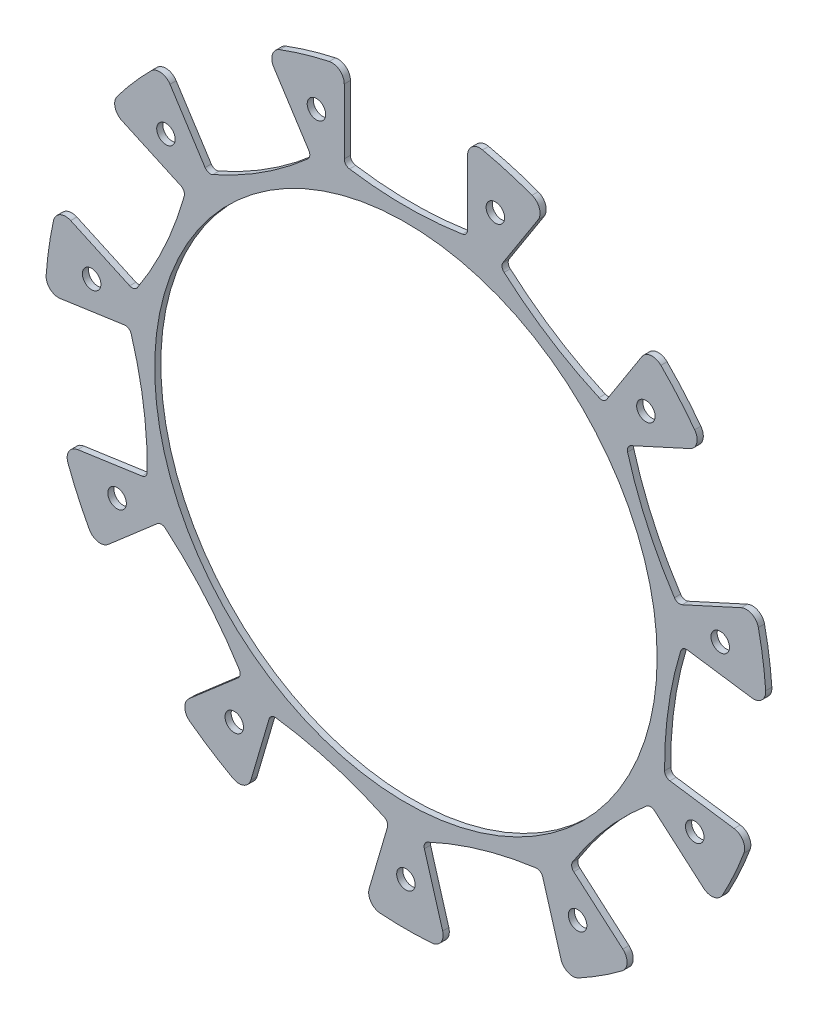
from build123d import *

# Parameters (mm, degrees)
SKETCH_2_R      = 40.75
SKETCH_2_R_2    = 1.5
EXTRUDE_1_DEPTH = 1
FILLET_1_R      = 1
FILLET_2_R      = 2


with BuildPart() as part:
    # 草图2 → 凸台-拉伸1 (new body)
    with BuildSketch(Plane.XY):
        with BuildLine():
            Line((10, 57.638962517), (10, 43.839202169))
            ThreePointArc((10, 43.839202169), (0, 43), (-10, 43.839202169))
            Line((-10, 43.839202169), (-10, 57.638962517))
            ThreePointArc((-10, 57.638962517), (-16.481354575, 56.130338956), (-22.749440484, 53.89538902))
            Line((-22.749440484, 53.89538902), (-15.288726769, 42.286291876))
            ThreePointArc((-15.288726769, 42.286291876), (-23.247555151, 36.173901912), (-32.113797426, 31.473475527))
            Line((-32.113797426, 31.473475527), (-39.574511141, 43.082572671))
            ThreePointArc((-39.574511141, 43.082572671), (-44.2113501, 38.309352936), (-48.276094354, 33.040410317))
            Line((-48.276094354, 33.040410317), (-35.723390814, 27.307782693))
            ThreePointArc((-35.723390814, 27.307782693), (-39.1141758, 17.862845559), (-44.031691074, 9.115142785))
            Line((-44.031691074, 9.115142785), (-56.584394614, 14.84777041))
            ThreePointArc((-56.584394614, 14.84777041), (-57.90455435, 8.325418039), (-58.47542937, 1.69533479))
            Line((-58.47542937, 1.69533479), (-44.816130685, 3.659245452))
            ThreePointArc((-44.816130685, 3.659245452), (-42.562322001, -6.119538046), (-41.969833919, -16.137183386))
            Line((-41.969833919, -16.137183386), (-55.629132604, -18.101094048))
            ThreePointArc((-55.629132604, -18.101094048), (-53.213471728, -24.301778261), (-50.109228728, -30.187997554))
            Line((-50.109228728, -30.187997554), (-39.680065719, -21.151076364))
            ThreePointArc((-39.680065719, -21.151076364), (-32.497231697, -28.15901156), (-26.58285104, -36.266067852))
            Line((-26.58285104, -36.266067852), (-37.012014049, -45.302989041))
            ThreePointArc((-37.012014049, -45.302989041), (-31.627487821, -49.213331671), (-25.83370202, -52.486853973))
            Line((-25.83370202, -52.486853973), (-21.945860253, -39.246080882))
            ThreePointArc((-21.945860253, -39.246080882), (-12.114499944, -41.258197865), (-2.756000781, -44.880732018))
            Line((-2.756000781, -44.880732018), (-6.643842547, -58.12150511))
            ThreePointArc((-6.643842547, -58.12150511), (0, -58.5), (6.643842547, -58.12150511))
            Line((6.643842547, -58.12150511), (2.756000781, -44.880732018))
            ThreePointArc((2.756000781, -44.880732018), (12.114499944, -41.258197865), (21.945860253, -39.246080882))
            Line((21.945860253, -39.246080882), (25.83370202, -52.486853973))
            ThreePointArc((25.83370202, -52.486853973), (31.627487821, -49.213331671), (37.012014049, -45.302989041))
            Line((37.012014049, -45.302989041), (26.58285104, -36.266067852))
            ThreePointArc((26.58285104, -36.266067852), (32.497231697, -28.15901156), (39.680065719, -21.151076364))
            Line((39.680065719, -21.151076364), (50.109228728, -30.187997554))
            ThreePointArc((50.109228728, -30.187997554), (53.213471728, -24.301778261), (55.629132604, -18.101094048))
            Line((55.629132604, -18.101094048), (41.969833919, -16.137183386))
            ThreePointArc((41.969833919, -16.137183386), (42.562322001, -6.119538046), (44.816130685, 3.659245452))
            Line((44.816130685, 3.659245452), (58.47542937, 1.69533479))
            ThreePointArc((58.47542937, 1.69533479), (57.90455435, 8.325418039), (56.584394614, 14.84777041))
            Line((56.584394614, 14.84777041), (44.031691074, 9.115142785))
            ThreePointArc((44.031691074, 9.115142785), (39.1141758, 17.862845559), (35.723390814, 27.307782693))
            Line((35.723390814, 27.307782693), (48.276094354, 33.040410317))
            ThreePointArc((48.276094354, 33.040410317), (44.2113501, 38.309352936), (39.574511141, 43.082572671))
            Line((39.574511141, 43.082572671), (32.113797426, 31.473475527))
            ThreePointArc((32.113797426, 31.473475527), (23.247555151, 36.173901912), (15.288726769, 42.286291876))
            Line((15.288726769, 42.286291876), (22.749440484, 53.89538902))
            ThreePointArc((22.749440484, 53.89538902), (16.481354575, 56.130338956), (10, 57.638962517))
        make_face()
        Circle(SKETCH_2_R, mode=Mode.SUBTRACT)
        with Locations((0, -51.5)):
            Circle(SKETCH_2_R_2, mode=Mode.SUBTRACT)
        with Locations((-27.843002099, -43.324556941)):
            Circle(SKETCH_2_R_2, mode=Mode.SUBTRACT)
        with Locations((-46.846047761, -21.39387317)):
            Circle(SKETCH_2_R_2, mode=Mode.SUBTRACT)
        with Locations((-50.975804257, 7.329214171)):
            Circle(SKETCH_2_R_2, mode=Mode.SUBTRACT)
        with Locations((-38.921103079, 33.725327798)):
            Circle(SKETCH_2_R_2, mode=Mode.SUBTRACT)
        with Locations((-14.509226677, 49.413888141)):
            Circle(SKETCH_2_R_2, mode=Mode.SUBTRACT)
        with Locations((14.509226677, 49.413888141)):
            Circle(SKETCH_2_R_2, mode=Mode.SUBTRACT)
        with Locations((38.921103079, 33.725327798)):
            Circle(SKETCH_2_R_2, mode=Mode.SUBTRACT)
        with Locations((50.975804257, 7.329214171)):
            Circle(SKETCH_2_R_2, mode=Mode.SUBTRACT)
        with Locations((46.846047761, -21.39387317)):
            Circle(SKETCH_2_R_2, mode=Mode.SUBTRACT)
        with Locations((27.843002099, -43.324556941)):
            Circle(SKETCH_2_R_2, mode=Mode.SUBTRACT)
    extrude(amount=EXTRUDE_1_DEPTH)

    # 圆角1
    fillet_1_edges = [part.edges().sort_by_distance(p)[0] for p in [
        (10, 43.839202169, 0.5),
        (-10, 43.839202169, 0.5),
        (-15.288726769, 42.286291876, 0.5),
        (-32.113797426, 31.473475527, 0.5),
        (-35.723390814, 27.307782693, 0.5),
        (-44.031691074, 9.115142785, 0.5),
        (-44.816130685, 3.659245452, 0.5),
        (-41.969833919, -16.137183386, 0.5),
        (-39.680065719, -21.151076364, 0.5),
        (-26.58285104, -36.266067852, 0.5),
        (-21.945860253, -39.246080882, 0.5),
        (-2.756000781, -44.880732018, 0.5),
        (2.756000781, -44.880732018, 0.5),
        (21.945860253, -39.246080882, 0.5),
        (26.58285104, -36.266067852, 0.5),
        (39.680065719, -21.151076364, 0.5),
        (41.969833919, -16.137183386, 0.5),
        (44.816130685, 3.659245452, 0.5),
        (44.031691074, 9.115142785, 0.5),
        (35.723390814, 27.307782693, 0.5),
        (32.113797426, 31.473475527, 0.5),
        (15.288726769, 42.286291876, 0.5),
    ]]
    fillet(fillet_1_edges, radius=FILLET_1_R)

    # 圆角2
    fillet_2_edges = [part.edges().sort_by_distance(p)[0] for p in [
        (10, 57.638962517, 0.5),
        (-10, 57.638962517, 0.5),
        (-22.749440484, 53.89538902, 0.5),
        (-39.574511141, 43.082572671, 0.5),
        (-48.276094354, 33.040410317, 0.5),
        (-56.584394614, 14.84777041, 0.5),
        (-58.47542937, 1.69533479, 0.5),
        (-55.629132604, -18.101094048, 0.5),
        (-50.109228728, -30.187997554, 0.5),
        (-37.012014049, -45.302989041, 0.5),
        (-25.83370202, -52.486853973, 0.5),
        (-6.643842547, -58.12150511, 0.5),
        (6.643842547, -58.12150511, 0.5),
        (25.83370202, -52.486853973, 0.5),
        (37.012014049, -45.302989041, 0.5),
        (50.109228728, -30.187997554, 0.5),
        (55.629132604, -18.101094048, 0.5),
        (58.47542937, 1.69533479, 0.5),
        (56.584394614, 14.84777041, 0.5),
        (48.276094354, 33.040410317, 0.5),
        (39.574511141, 43.082572671, 0.5),
        (22.749440484, 53.89538902, 0.5),
    ]]
    fillet(fillet_2_edges, radius=FILLET_2_R)


solid = part.part
